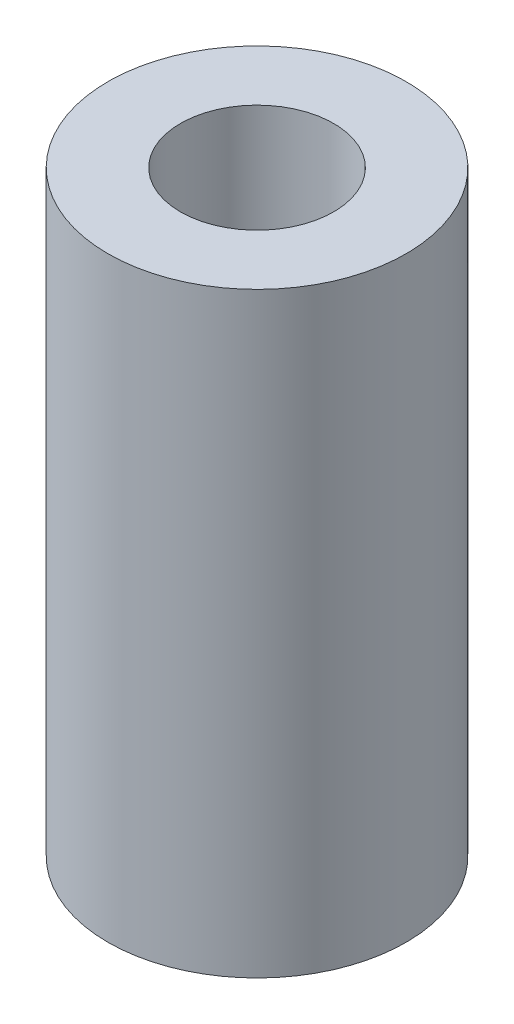
from build123d import *

# Parameters (mm, degrees)
SKETCH1_R           = 6.35
SKETCH1_R_2         = 3.2639
BOSS_EXTRUDE1_DEPTH = 25.4


with BuildPart() as part:
    # Sketch1 → Boss-Extrude1 (new body)
    with BuildSketch(Plane(origin=(0, 0, 0), x_dir=(1, 0, 0), z_dir=(0, 1, 0))):
        with Locations(Location((0, 0, 0), (0, 0, 270))):
            Circle(SKETCH1_R)
        with Locations(Location((0, 0, 0), (0, 0, 270))):
            Circle(SKETCH1_R_2, mode=Mode.SUBTRACT)
    extrude(amount=BOSS_EXTRUDE1_DEPTH)


solid = part.part
